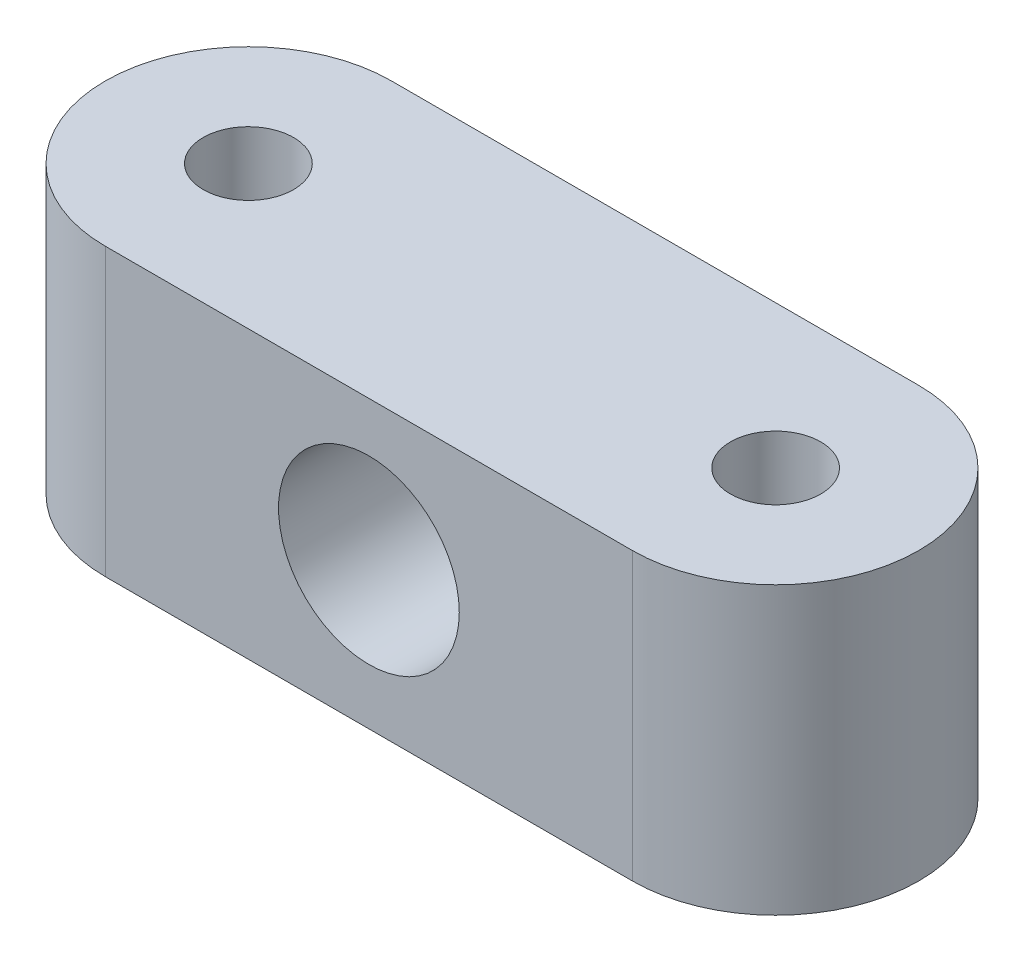
from build123d import *

# Parameters (mm, degrees)
SZKIC1_R                    = 6
DODANIE_WYCI_GNI_CIE1_DEPTH = 38
SZKIC2_R                    = 12
WYTNIJ_WYCI_GNI_CIE2_DEPTH  = 104.966340707


with BuildPart() as part:
    # Szkic1 → Dodanie-wyciągnięcie1 (new body)
    with BuildSketch(Plane(origin=(0, 0, 0), x_dir=(1, 0, 0), z_dir=(0, 1, 0))):
        with BuildLine():
            Line((0, 19), (70, 19))
            ThreePointArc((70, 19), (89, 0), (70, -19))
            Line((70, -19), (0, -19))
            ThreePointArc((0, -19), (-19, 0), (0, 19))
        make_face()
        with Locations(Location((0, 0, 0), (0, 0, 270))):
            Circle(SZKIC1_R, mode=Mode.SUBTRACT)
        with Locations(Location((70, 0, 0), (0, 0, 270))):
            Circle(SZKIC1_R, mode=Mode.SUBTRACT)
    extrude(amount=DODANIE_WYCI_GNI_CIE1_DEPTH)

    # Szkic2 → Wytnij-wyciągnięcie2 (cut, through all)
    with BuildSketch(Plane.XY.offset(19)):
        with Locations((35, 19.402617886)):
            Circle(SZKIC2_R)
    extrude(amount=-WYTNIJ_WYCI_GNI_CIE2_DEPTH, mode=Mode.SUBTRACT)


solid = part.part
